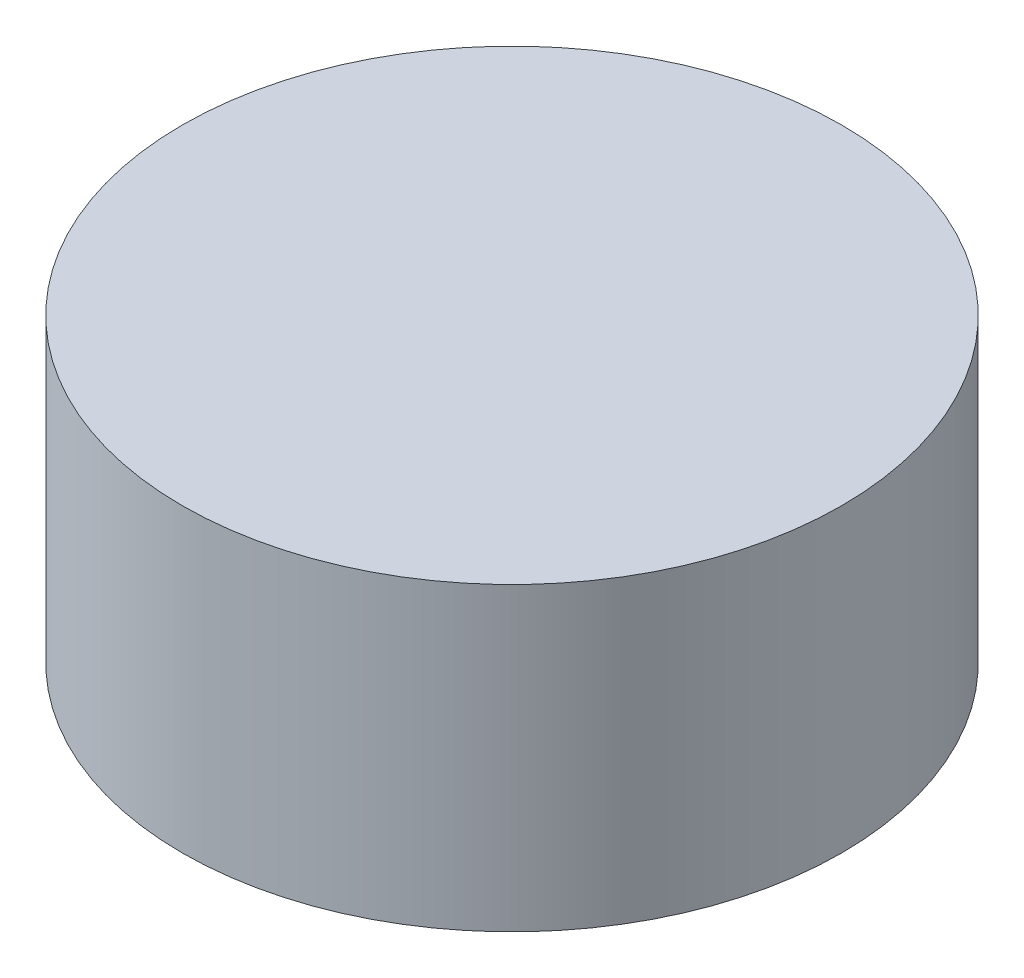
from build123d import *

# Parameters (mm, degrees)
SKETCH_1_R      = 55
EXTRUDE_1_DEPTH = 50
SHELL_1_T       = 2


with BuildPart() as part:
    # 草图1 → 凸台-拉伸1 (new body)
    with BuildSketch(Plane(origin=(0, 0, 0), x_dir=(1, 0, 0), z_dir=(0, 1, 0))):
        with Locations(Location((0, 0, 0), (0, 0, 270))):
            Circle(SKETCH_1_R)
    extrude(amount=EXTRUDE_1_DEPTH)

    # 抽壳1
    shell_1_openings = [part.faces().sort_by_distance(p)[0] for p in [
        (0, 0, 0),
    ]]
    offset(amount=SHELL_1_T, openings=shell_1_openings, kind=Kind.INTERSECTION)


solid = part.part
